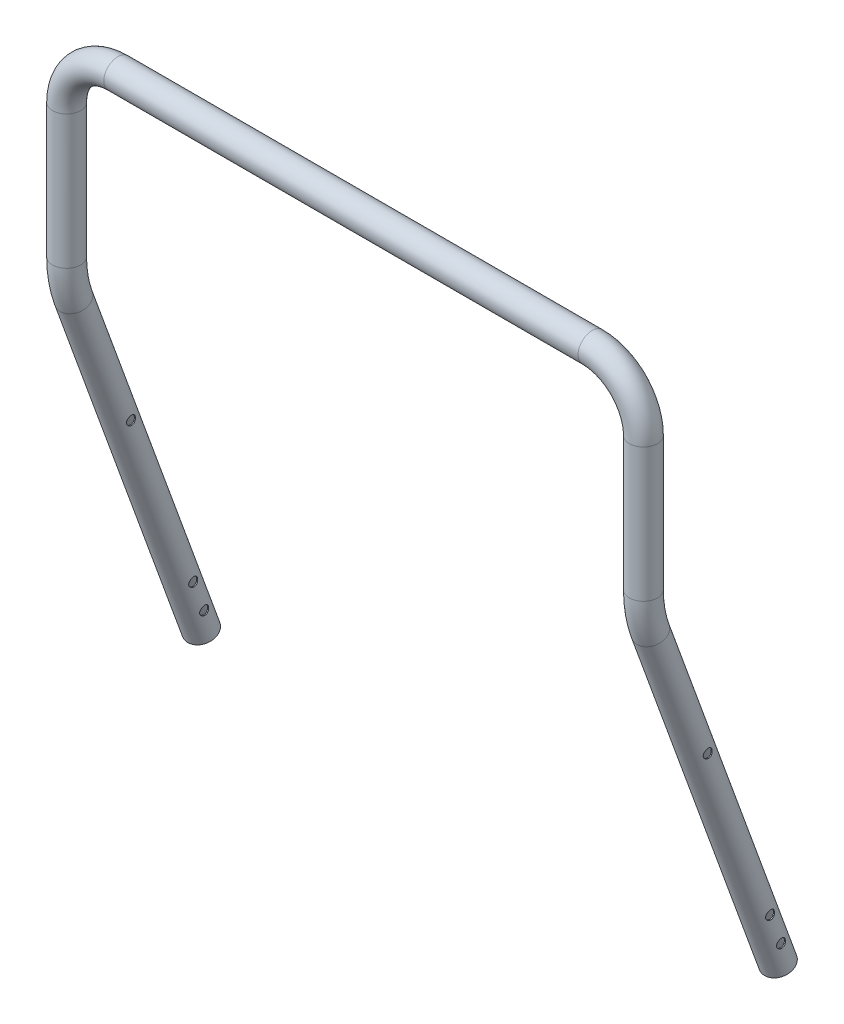
from build123d import *

# Parameters (mm, degrees)
SKETCH9_R                      = 11
SKETCH9_R_2                    = 10.2
SKETCH9_2_R                    = 11
SKETCH9_2_R_2                  = 10.2
CUT_EXTRUDE1_REACH             = 658.034
SKETCH14_R                     = 3.5
CUT_EXTRUDE1_DIRECTION_2_REACH = 658.034


with BuildPart() as part:
    # Sweep2: sweep along a path in Sketch8
    with BuildLine(Plane.XY) as sweep2_path:
        Line((-225, -100), (-225, -40))
        ThreePointArc((-225, -40), (-213.284271247, -11.715728753), (-185, 0))
        Line((-185, 0), (185, 0))
        ThreePointArc((185, 0), (213.284271247, -11.715728753), (225, -40))
        Line((225, -40), (225, -100))
    # Sketch9 → Sweep2 (sweep)
    with BuildSketch(Plane(origin=(225, -100, 0), x_dir=(-1, 0, 0), z_dir=(0, -1, 0))):
        Circle(SKETCH9_R)
        Circle(SKETCH9_R_2, mode=Mode.SUBTRACT)
    sweep(path=sweep2_path.line)

    # Sweep3: sweep along a path in Sketch13
    with BuildLine(Plane(origin=(225, 0, 0), x_dir=(0, 0, -1), z_dir=(1, 0, 0))) as sweep3_path:
        Line((0, -100), (0, -144.259708793))
        ThreePointArc((0, -144.259708793), (1.367302229, -159.888044783), (5.427664129, -175.041521693))
        Line((5.427664129, -175.041521693), (104.967762343, -448.525693866))
    # Sketch9<2> → Sweep3 (sweep)
    with BuildSketch(Plane(origin=(225, -100, 0), x_dir=(-1, 0, 0), z_dir=(0, -1, 0))):
        Circle(SKETCH9_2_R)
        Circle(SKETCH9_2_R_2, mode=Mode.SUBTRACT)
    sweep3 = sweep(path=sweep3_path.line)

    # Mirror1: Sweep3 across plane
    add(sweep3.mirror(Plane(origin=(0, 0, 0), x_dir=(0, 0, 1), z_dir=(1, 0, 0))))

    # Sketch14 → Cut-Extrude1 (cut, up to next)
    with BuildSketch(Plane(origin=(225, 0, 0), x_dir=(0, 0, -1), z_dir=(1, 0, 0)), mode=Mode.PRIVATE) as cut_extrude1_sk1:
        with Locations((39.659649746, -269.093129199)):
            Circle(SKETCH14_R)
    cut_extrude1_tool1 = extrude(cut_extrude1_sk1.sketch, amount=-CUT_EXTRUDE1_REACH, mode=Mode.PRIVATE) & part.part
    # Sketch14 → Cut-Extrude1 (cut, up to next)
    with BuildSketch(Plane(origin=(225, 0, 0), x_dir=(0, 0, -1), z_dir=(1, 0, 0)), mode=Mode.PRIVATE) as cut_extrude1_sk2:
        with Locations((88.226510099, -402.52948135)):
            Circle(SKETCH14_R)
    cut_extrude1_tool2 = extrude(cut_extrude1_sk2.sketch, amount=-CUT_EXTRUDE1_REACH, mode=Mode.PRIVATE) & part.part
    # Sketch14 → Cut-Extrude1 (cut, up to next)
    with BuildSketch(Plane(origin=(225, 0, 0), x_dir=(0, 0, -1), z_dir=(1, 0, 0)), mode=Mode.PRIVATE) as cut_extrude1_sk3:
        with Locations((96.777013682, -426.02179687)):
            Circle(SKETCH14_R)
    cut_extrude1_tool3 = extrude(cut_extrude1_sk3.sketch, amount=-CUT_EXTRUDE1_REACH, mode=Mode.PRIVATE) & part.part
    cut_extrude1_1 = cut_extrude1_tool1.solids().sort_by_distance((225, -269.093129, -39.65965))[0]
    add(cut_extrude1_1, mode=Mode.SUBTRACT)
    cut_extrude1_2 = cut_extrude1_tool2.solids().sort_by_distance((225, -402.529481, -88.22651))[0]
    add(cut_extrude1_2, mode=Mode.SUBTRACT)
    cut_extrude1_3 = cut_extrude1_tool3.solids().sort_by_distance((225, -426.021797, -96.777014))[0]
    add(cut_extrude1_3, mode=Mode.SUBTRACT)
    cut_extrude1 = cut_extrude1_1 + cut_extrude1_2 + cut_extrude1_3  # Cut-Extrude1 as one shape, for the pattern or mirror that repeats it

    # Sketch14 → Cut-Extrude1 direction 2 (cut, up to next)
    with BuildSketch(Plane(origin=(225, 0, 0), x_dir=(0, 0, -1), z_dir=(1, 0, 0)), mode=Mode.PRIVATE) as cut_extrude1_direction_2_sk1:
        with Locations((39.659649746, -269.093129199)):
            Circle(SKETCH14_R)
    cut_extrude1_direction_2_tool1 = extrude(cut_extrude1_direction_2_sk1.sketch, amount=CUT_EXTRUDE1_DIRECTION_2_REACH, mode=Mode.PRIVATE) & part.part
    # Sketch14 → Cut-Extrude1 direction 2 (cut, up to next)
    with BuildSketch(Plane(origin=(225, 0, 0), x_dir=(0, 0, -1), z_dir=(1, 0, 0)), mode=Mode.PRIVATE) as cut_extrude1_direction_2_sk2:
        with Locations((88.226510099, -402.52948135)):
            Circle(SKETCH14_R)
    cut_extrude1_direction_2_tool2 = extrude(cut_extrude1_direction_2_sk2.sketch, amount=CUT_EXTRUDE1_DIRECTION_2_REACH, mode=Mode.PRIVATE) & part.part
    # Sketch14 → Cut-Extrude1 direction 2 (cut, up to next)
    with BuildSketch(Plane(origin=(225, 0, 0), x_dir=(0, 0, -1), z_dir=(1, 0, 0)), mode=Mode.PRIVATE) as cut_extrude1_direction_2_sk3:
        with Locations((96.777013682, -426.02179687)):
            Circle(SKETCH14_R)
    cut_extrude1_direction_2_tool3 = extrude(cut_extrude1_direction_2_sk3.sketch, amount=CUT_EXTRUDE1_DIRECTION_2_REACH, mode=Mode.PRIVATE) & part.part
    cut_extrude1_direction_2_1 = cut_extrude1_direction_2_tool1.solids().sort_by_distance((225, -269.093129, -39.65965))[0]
    add(cut_extrude1_direction_2_1, mode=Mode.SUBTRACT)
    cut_extrude1_direction_2_2 = cut_extrude1_direction_2_tool2.solids().sort_by_distance((225, -402.529481, -88.22651))[0]
    add(cut_extrude1_direction_2_2, mode=Mode.SUBTRACT)
    cut_extrude1_direction_2_3 = cut_extrude1_direction_2_tool3.solids().sort_by_distance((225, -426.021797, -96.777014))[0]
    add(cut_extrude1_direction_2_3, mode=Mode.SUBTRACT)
    cut_extrude1_direction_2 = cut_extrude1_direction_2_1 + cut_extrude1_direction_2_2 + cut_extrude1_direction_2_3  # Cut-Extrude1 direction 2 as one shape, for the pattern or mirror that repeats it

    # Mirror2: Cut-Extrude1, Cut-Extrude1 direction 2 across plane
    add(cut_extrude1.mirror(Plane(origin=(0, 0, 0), x_dir=(0, 0, 1), z_dir=(1, 0, 0))), mode=Mode.SUBTRACT)
    add(cut_extrude1_direction_2.mirror(Plane(origin=(0, 0, 0), x_dir=(0, 0, 1), z_dir=(1, 0, 0))), mode=Mode.SUBTRACT)


solid = part.part
